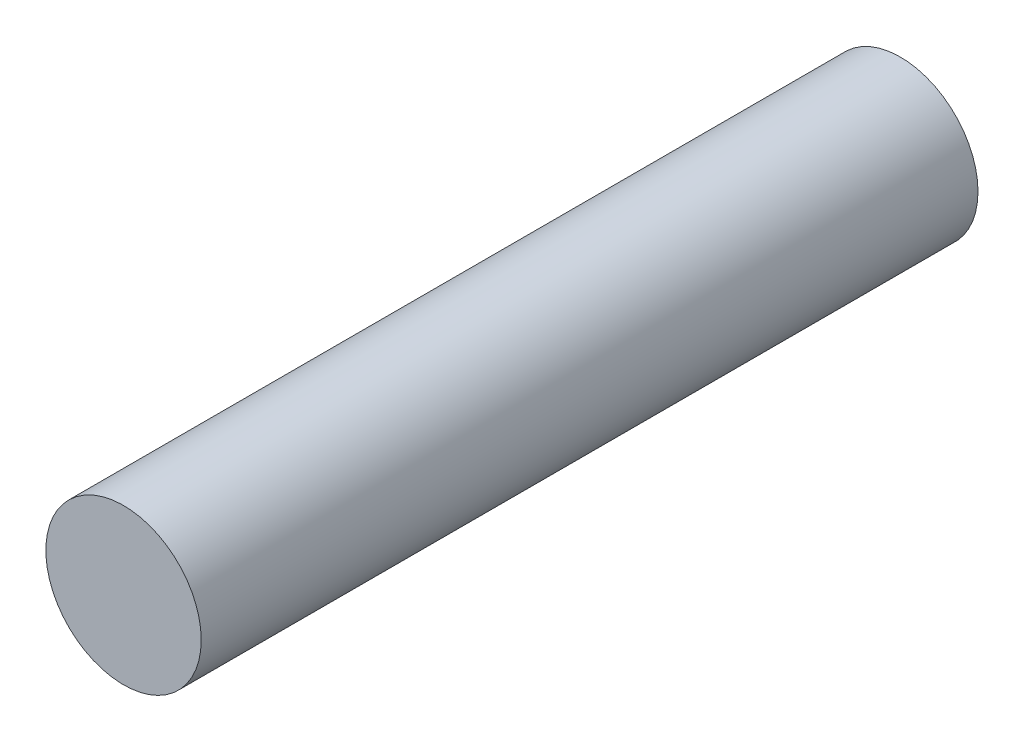
from build123d import *

# Parameters (mm, degrees)
SKETCH2_R           = 15
BOSS_EXTRUDE1_DEPTH = 150


with BuildPart() as part:
    # Sketch2 → Boss-Extrude1 (new body)
    with BuildSketch(Plane.XY):
        Circle(SKETCH2_R)
    extrude(amount=BOSS_EXTRUDE1_DEPTH)


solid = part.part
